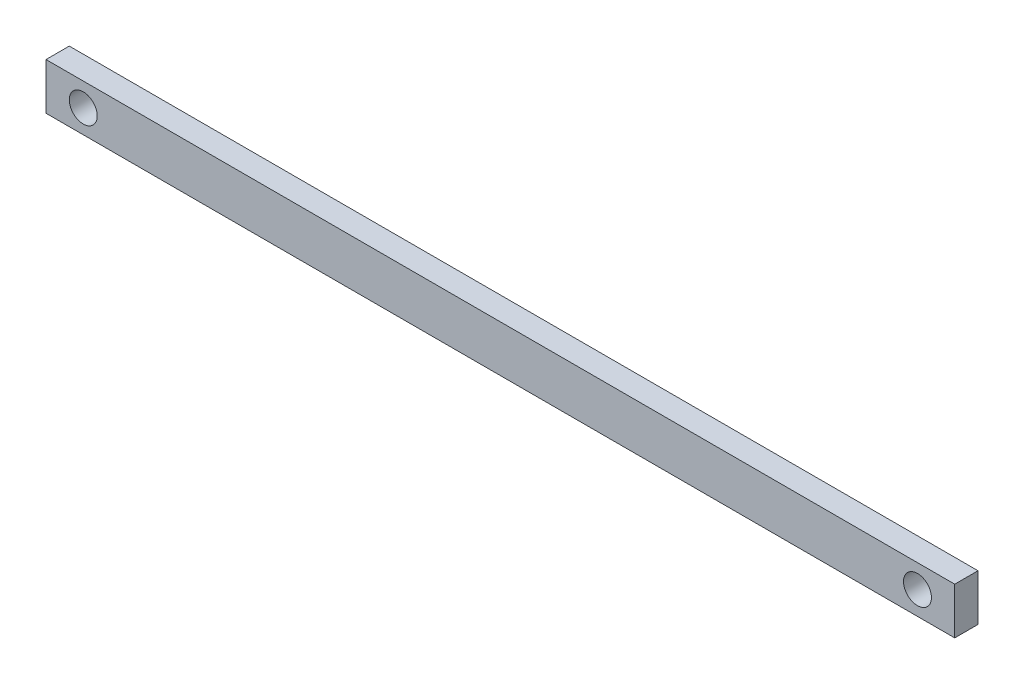
from build123d import *

# Parameters (mm, degrees)
SKETCH1_W               = 488
SKETCH1_H               = 25
SKETCH1_R               = 7.5
BOSS_EXTRUDE1_DEPTH     = 25
CUT_EXTRUDE1_DEPTH      = 489.799805646
CUT_EXTRUDE1_DEPTH_BACK = 489.799805646
SKETCH2_W               = 12.5
SKETCH2_H               = 25


with BuildPart() as part:
    # Sketch1 → Boss-Extrude1 (new body)
    with BuildSketch(Plane.XY):
        Rectangle(SKETCH1_W, SKETCH1_H)
        with Locations((-224, 0)):
            Circle(SKETCH1_R, mode=Mode.SUBTRACT)
        with Locations((224, 0)):
            Circle(SKETCH1_R, mode=Mode.SUBTRACT)
    extrude(amount=BOSS_EXTRUDE1_DEPTH)

    # Sketch2 → Cut-Extrude1 (cut, two sides: drawn at the far end of the back side and taken through both)
    with BuildSketch(Plane(origin=(244, 0, 0), x_dir=(0, 0, -1), z_dir=(1, 0, 0)).offset(-CUT_EXTRUDE1_DEPTH_BACK)):
        with Locations((-6.25, 0)):
            Rectangle(SKETCH2_W, SKETCH2_H)
    extrude(amount=CUT_EXTRUDE1_DEPTH + CUT_EXTRUDE1_DEPTH_BACK, mode=Mode.SUBTRACT)


solid = part.part
